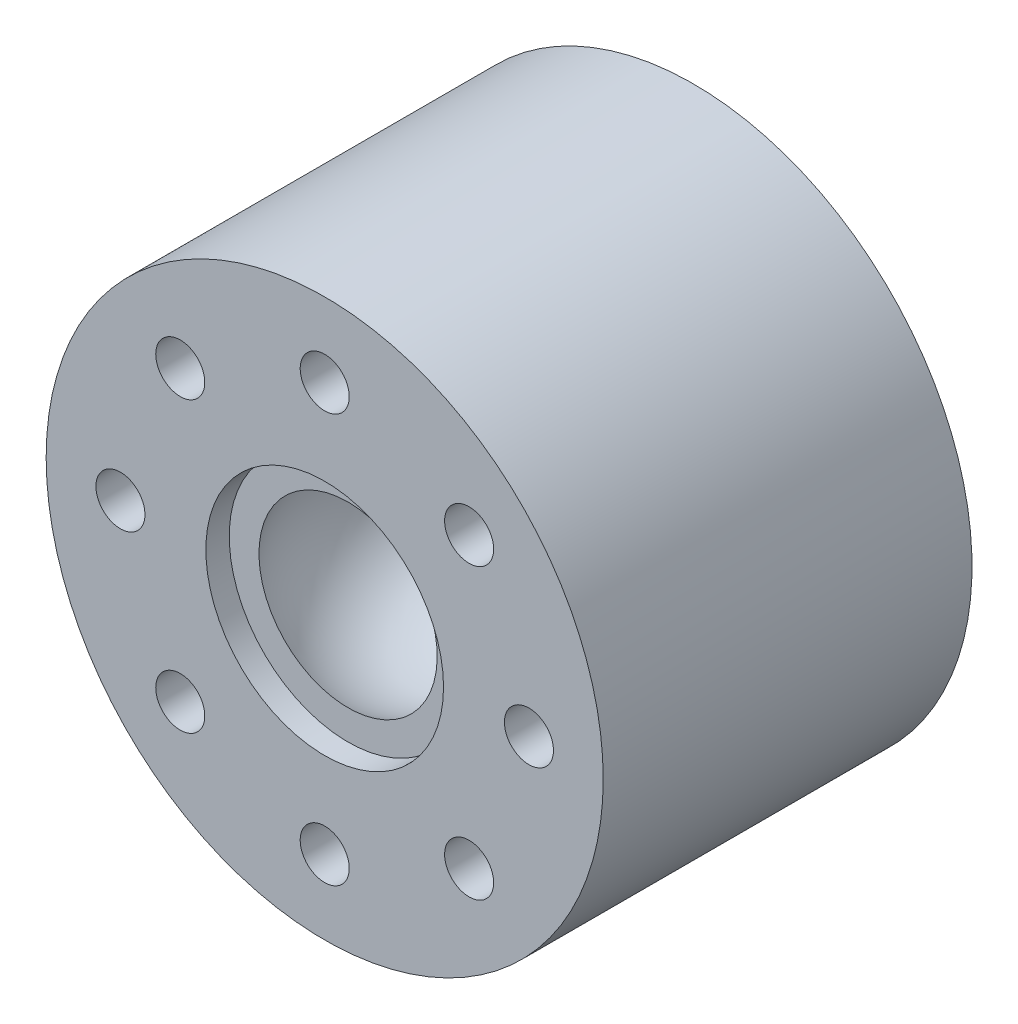
from build123d import *

# Parameters (mm, degrees)
SKETCH1_R           = 37.5
BOSS_EXTRUDE1_DEPTH = 55
SKETCH2_R           = 16
CUT_EXTRUDE1_DEPTH  = 16
SKETCH3_R           = 16
CUT_EXTRUDE2_DEPTH  = 2.5
SKETCH6_R           = 8.9296875
CUT_EXTRUDE3_DEPTH  = 12.7
CUT_EXTRUDE4_START  = -15.35
SKETCH7_R           = 37.5
CUT_EXTRUDE4_DEPTH  = 15.35
SKETCH9_R           = 3.302
CUT_EXTRUDE6_DEPTH  = 67.216482087
BOSS_EXTRUDE2_START = 10
SKETCH10_R          = 37.5
SKETCH10_R_2        = 8.9296875
SKETCH10_R_3        = 3.302
BOSS_EXTRUDE2_DEPTH = 10


with BuildPart() as part:
    # Sketch1 → Boss-Extrude1 (new body)
    with BuildSketch(Plane.XY):
        Circle(SKETCH1_R)
    extrude(amount=BOSS_EXTRUDE1_DEPTH)

    # Sketch2 → Cut-Extrude1 (cut)
    with BuildSketch(Plane.XY.offset(55)):
        Circle(SKETCH2_R)
    extrude(amount=-CUT_EXTRUDE1_DEPTH, mode=Mode.SUBTRACT)

    # Sketch3 → Cut-Extrude2 (cut)
    with BuildSketch(Plane.XY.offset(39)):
        Circle(SKETCH3_R)
    extrude(amount=-CUT_EXTRUDE2_DEPTH, mode=Mode.SUBTRACT)

    # Sketch4 → Cut-Revolve1 (revolve, cut)
    with BuildSketch(Plane(origin=(0, 0, 0), x_dir=(0, 0, -1), z_dir=(1, 0, 0))):
        with BuildLine():
            Line((-12.7, 8.9281), (-12.7, 0))
            Line((-12.7, 0), (-36.5, 0))
            Line((-36.5, 0), (-36.5, 12))
            add(Edge.make_bspline(
                [(-36.5, 12), (-28.343745376, 16.523417527), (-19.165864626, 14.261468976), (-12.7, 8.9281)],
                knots=[0, 0, 0, 0, 1, 1, 1, 1], degree=3))
        make_face()
    revolve(axis=Axis((0, 0, 12.7), (0, 0, 1)), mode=Mode.SUBTRACT)

    # Sketch6 → Cut-Extrude3 (cut)
    with BuildSketch(Plane(origin=(0, 0, 0), x_dir=(-1, 0, 0), z_dir=(0, 0, -1))):
        Circle(SKETCH6_R)
    extrude(amount=-CUT_EXTRUDE3_DEPTH, mode=Mode.SUBTRACT)

    # Sketch7 → Cut-Extrude4 (cut)
    with BuildSketch(Plane.XY.offset(55).offset(CUT_EXTRUDE4_START)):
        Circle(SKETCH7_R)
    extrude(amount=CUT_EXTRUDE4_DEPTH, mode=Mode.SUBTRACT)

    # Sketch9 → Cut-Extrude6 (cut, through all)
    with BuildSketch(Plane(origin=(0, 0, 0), x_dir=(-1, 0, 0), z_dir=(0, 0, -1))):
        with Locations((0, -27.5)):
            Circle(SKETCH9_R)
        with Locations((-19.445436483, -19.445436483)):
            Circle(SKETCH9_R)
        with Locations((-27.5, 0)):
            Circle(SKETCH9_R)
        with Locations((-19.445436483, 19.445436483)):
            Circle(SKETCH9_R)
        with Locations((0, 27.5)):
            Circle(SKETCH9_R)
        with Locations((19.445436483, 19.445436483)):
            Circle(SKETCH9_R)
        with Locations((27.5, 0)):
            Circle(SKETCH9_R)
        with Locations((19.445436483, -19.445436483)):
            Circle(SKETCH9_R)
    extrude(amount=-CUT_EXTRUDE6_DEPTH, mode=Mode.SUBTRACT)

    # Sketch10 → Boss-Extrude2 (add)
    with BuildSketch(Plane(origin=(0, 0, 0), x_dir=(-1, 0, 0), z_dir=(0, 0, -1)).offset(BOSS_EXTRUDE2_START)):
        Circle(SKETCH10_R)
        Circle(SKETCH10_R_2, mode=Mode.SUBTRACT)
        with Locations((-27.5, 0)):
            Circle(SKETCH10_R_3, mode=Mode.SUBTRACT)
        with Locations((-19.445436483, -19.445436483)):
            Circle(SKETCH10_R_3, mode=Mode.SUBTRACT)
        with Locations((0, -27.5)):
            Circle(SKETCH10_R_3, mode=Mode.SUBTRACT)
        with Locations((19.445436483, -19.445436483)):
            Circle(SKETCH10_R_3, mode=Mode.SUBTRACT)
        with Locations((27.5, 0)):
            Circle(SKETCH10_R_3, mode=Mode.SUBTRACT)
        with Locations((19.445436483, 19.445436483)):
            Circle(SKETCH10_R_3, mode=Mode.SUBTRACT)
        with Locations((0, 27.5)):
            Circle(SKETCH10_R_3, mode=Mode.SUBTRACT)
        with Locations((-19.445436483, 19.445436483)):
            Circle(SKETCH10_R_3, mode=Mode.SUBTRACT)
    extrude(amount=-BOSS_EXTRUDE2_DEPTH)


solid = part.part
